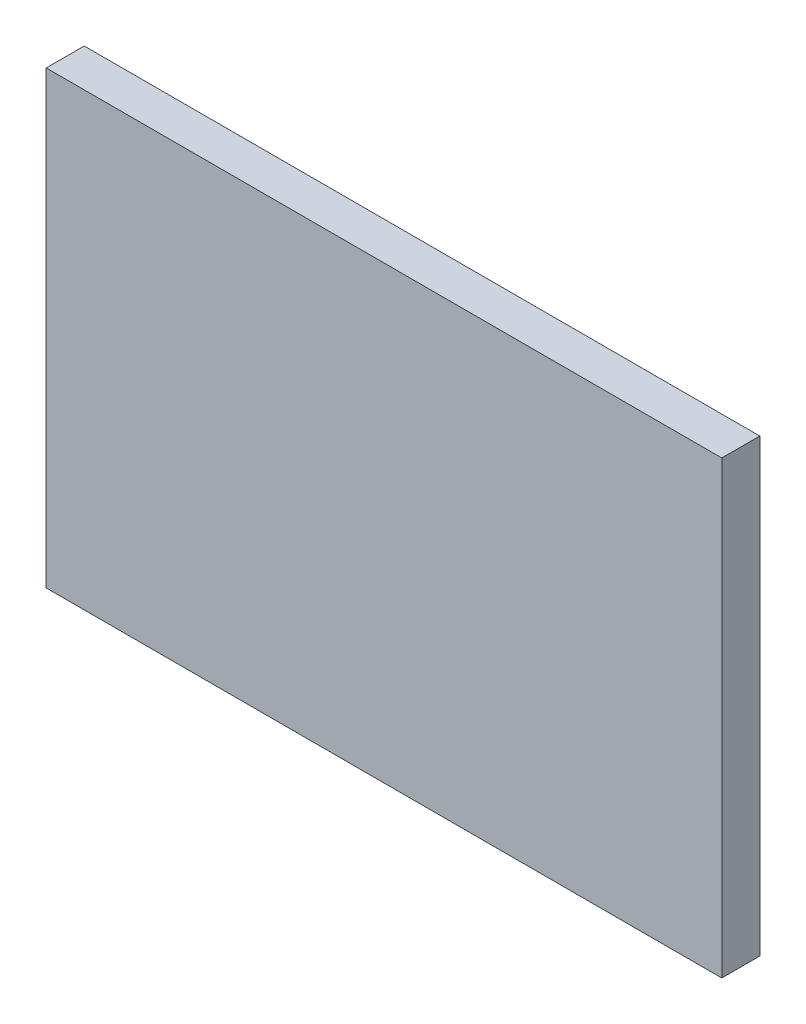
from build123d import *

# Parameters (mm, degrees)
SKETCH1_W           = 104.775
SKETCH1_H           = 69.85
BOSS_EXTRUDE1_DEPTH = 5.8928


with BuildPart() as part:
    # Sketch1 → Boss-Extrude1 (new body)
    with BuildSketch(Plane.XY):
        with Locations((-107.380896226, -96.448113208)):
            Rectangle(SKETCH1_W, SKETCH1_H)
    extrude(amount=BOSS_EXTRUDE1_DEPTH)


solid = part.part
